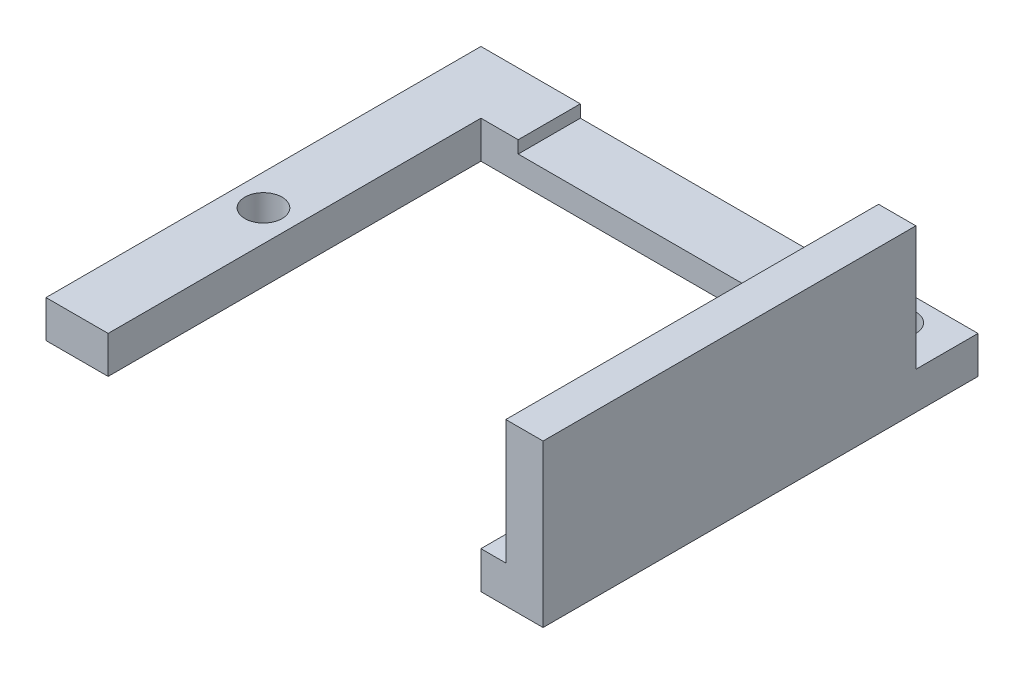
from build123d import *

# Parameters (mm, degrees)
BOSS_EXTRUDE1_DEPTH = 3
SKETCH2_R           = 1.5
CUT_EXTRUDE1_DEPTH  = 3
SKETCH3_W           = 24
SKETCH3_H           = 5
CUT_EXTRUDE2_DEPTH  = 1
SKETCH4_W           = 3
SKETCH4_H           = 30
BOSS_EXTRUDE2_DEPTH = 10
SKETCH5_R           = 1.5
CUT_EXTRUDE3_DEPTH  = 3


with BuildPart() as part:
    # Sketch1 → Boss-Extrude1 (new body)
    with BuildSketch(Plane(origin=(0, 0, 0), x_dir=(1, 0, 0), z_dir=(0, 1, 0))):
        Polygon((20, -11.899861304), (15, -11.899861304), (15, 18.100138696), (-15, 18.100138696), (-15, -11.899861304), (-20, -11.899861304), (-20, 23.100138696), (20, 23.100138696), align=None)
    extrude(amount=BOSS_EXTRUDE1_DEPTH)

    # Sketch2 → Cut-Extrude1 (cut)
    with BuildSketch(Plane(origin=(0, 3, 0), x_dir=(1, 0, 0), z_dir=(0, 1, 0))):
        with Locations(Location((-17.5, 3.100138696, 0), (0, 0, 90))):
            Circle(SKETCH2_R)
    extrude(amount=-CUT_EXTRUDE1_DEPTH, mode=Mode.SUBTRACT)

    # Sketch3 → Cut-Extrude2 (cut)
    with BuildSketch(Plane(origin=(0, 3, 0), x_dir=(1, 0, 0), z_dir=(0, 1, 0))):
        with Locations((0, 20.600138696)):
            Rectangle(SKETCH3_W, SKETCH3_H)
    extrude(amount=-CUT_EXTRUDE2_DEPTH, mode=Mode.SUBTRACT)

    # Sketch4 → Boss-Extrude2 (add)
    with BuildSketch(Plane(origin=(0, 3, 0), x_dir=(1, 0, 0), z_dir=(0, 1, 0))):
        with Locations((18.5, 3.100138696)):
            Rectangle(SKETCH4_W, SKETCH4_H)
    extrude(amount=BOSS_EXTRUDE2_DEPTH)

    # Sketch5 → Cut-Extrude3 (cut)
    with BuildSketch(Plane(origin=(0, 3, 0), x_dir=(1, 0, 0), z_dir=(0, 1, 0))):
        with Locations(Location((16, 20.600138696, 0), (0, 0, 270))):
            Circle(SKETCH5_R)
    extrude(amount=-CUT_EXTRUDE3_DEPTH, mode=Mode.SUBTRACT)


solid = part.part
